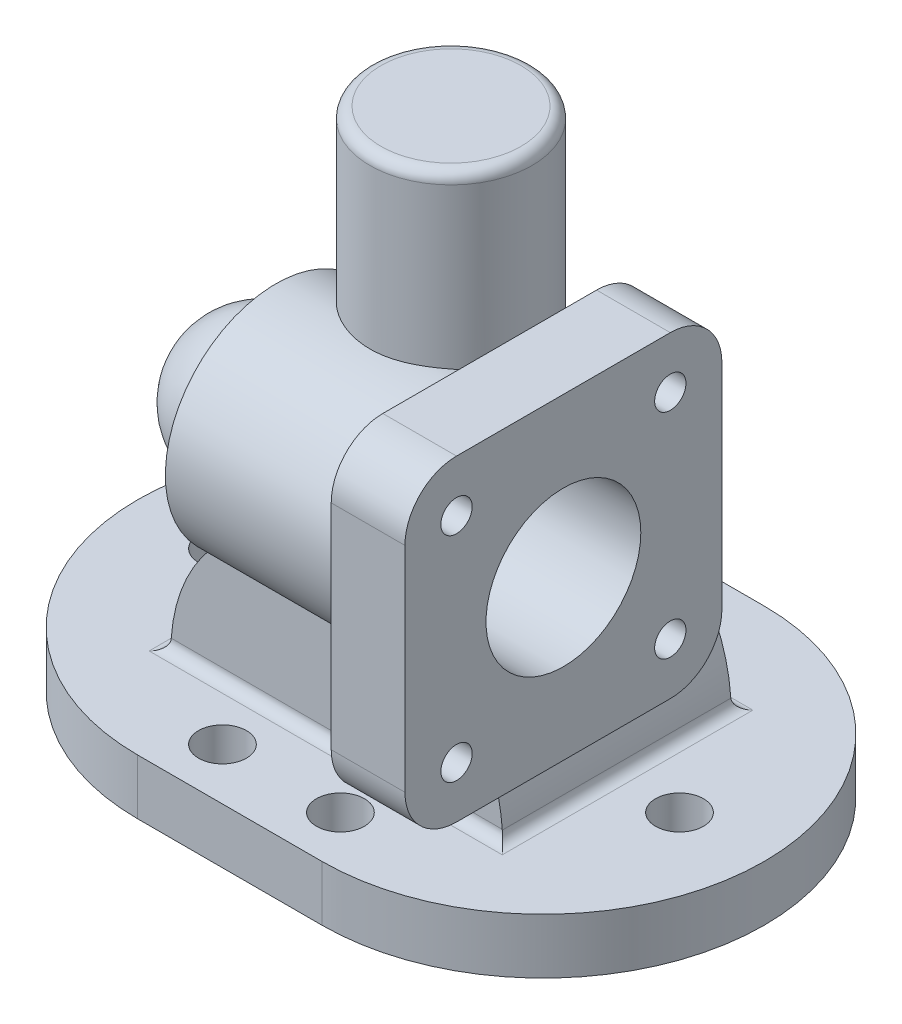
from build123d import *

# Parameters (mm, degrees)
EXTRUDE_1_DEPTH          = 15
EXTRUDE_2_DEPTH          = 31
EXTRUDE_START            = 30
SKETCH_3_W               = 86
SKETCH_3_H               = 86
EXTRUDE_3_DEPTH          = 20
SKETCH_4_R               = 30
EXTRUDE_4_DEPTH          = 58
SKETCH_5_R               = 22
EXTRUDE_5_DEPTH          = 150
SKETCH_6_R               = 20
EXTRUDE_6_DEPTH          = 4
DOME_1_FACE_RADIUS       = 20
DOME_1_HEIGHT            = 20
CUT_EXTRUDE_START        = -10
SKETCH_7_R               = 12
CUT_EXTRUDE_1_DEPTH      = 174.388249351
SKETCH_8_R               = 21
CUT_EXTRUDE_2_DEPTH      = 65
MM_1_D                   = 18
MM_1_DEPTH               = 20
MM_1_TIP                 = 5.407745571
CUT_EXTRUDE_3_DEPTH      = 21
FILLET_1_R               = 14
HOLE_WIZARD_M10_1_REACH  = 203.51
HOLE_WIZARD_M10_1_BORE_R = 4.25
SKETCH_14_R              = 6.5
CUT_EXTRUDE_4_DEPTH      = 172.336656986
FILLET_2_R               = 3
FILLET_3_R               = 3
FILLET_4_R               = 3
FILLET_5_R               = 3


with BuildPart() as part:
    # 草图1 → 凸台-拉伸1 (new body)
    with BuildSketch(Plane(origin=(0, 0, 0), x_dir=(1, 0, 0), z_dir=(0, 1, 0))):
        with BuildLine():
            Line((25, -60), (-25, -60))
            ThreePointArc((-25, -60), (-85, 0), (-25, 60))
            Line((-25, 60), (25, 60))
            ThreePointArc((25, 60), (85, 0), (25, -60))
        make_face()
    extrude(amount=EXTRUDE_1_DEPTH)

    # 草图2 → 凸台-拉伸2 (add, symmetric)
    with BuildSketch(Plane.XY):
        with BuildLine():
            ThreePointArc((45, 15), (0, 60), (-45, 15))
            Line((-45, 15), (-35, 15))
            ThreePointArc((-35, 15), (0, 50), (35, 15))
            Line((35, 15), (45, 15))
        make_face()
        with BuildLine():
            ThreePointArc((35, 15), (0, 50), (-35, 15))
            Line((-35, 15), (35, 15))
        make_face()
    extrude(amount=EXTRUDE_2_DEPTH, both=True)

    # 草图3 → 凸台-拉伸3 (add)
    with BuildSketch(Plane(origin=(0, 0, 0), x_dir=(0, 0, -1), z_dir=(1, 0, 0)).offset(EXTRUDE_START)):
        with Locations((-19.5, 74)):
            Rectangle(SKETCH_3_W, SKETCH_3_H)
    extrude(amount=EXTRUDE_3_DEPTH)

    # 草图4 → 凸台-拉伸4 (add)
    with BuildSketch(Plane.ZY.offset(-30)):
        with Locations((19.5, 74)):
            Circle(SKETCH_4_R)
    extrude(amount=EXTRUDE_4_DEPTH)

    # 草图5 → 凸台-拉伸5 (add)
    with BuildSketch(Plane.XZ):
        with Locations(Location((0, 0, 0), (0, 0, 270))):
            Circle(SKETCH_5_R)
    extrude(amount=-EXTRUDE_5_DEPTH)

    # 草图6 → 凸台-拉伸6 (add)
    with BuildSketch(Plane.ZY.offset(28)):
        with Locations((19.5, 74)):
            Circle(SKETCH_6_R)
    extrude(amount=EXTRUDE_6_DEPTH)

    # 圆顶1: a dome of height H over a round flat face of radius A is a cap of a sphere of radius (A * A + H * H) / (2 * H)
    dome_1_r = (DOME_1_FACE_RADIUS * DOME_1_FACE_RADIUS + DOME_1_HEIGHT * DOME_1_HEIGHT) / (2 * DOME_1_HEIGHT)
    dome_1_base = Plane((-32, 74, 19.5), z_dir=(-1, 0, 0))
    with Locations(dome_1_base.offset(DOME_1_HEIGHT - dome_1_r)):
        dome_1_ball = Sphere(dome_1_r, mode=Mode.PRIVATE)
    add(split(dome_1_ball, bisect_by=dome_1_base, keep=Keep.TOP, mode=Mode.PRIVATE))

    # 草图7 → 切除-拉伸1 (cut, through all)
    with BuildSketch(Plane(origin=(0, 150, 0), x_dir=(1, 0, 0), z_dir=(0, 1, 0)).offset(CUT_EXTRUDE_START)):
        with Locations(Location((0, 0, 0), (0, 0, 270))):
            Circle(SKETCH_7_R)
    extrude(amount=-CUT_EXTRUDE_1_DEPTH, mode=Mode.SUBTRACT)

    # 草图8 → 切除-拉伸2 (cut)
    with BuildSketch(Plane(origin=(50, 0, 0), x_dir=(0, 0, -1), z_dir=(1, 0, 0))):
        with Locations((-19.5, 74)):
            Circle(SKETCH_8_R)
    extrude(amount=-CUT_EXTRUDE_2_DEPTH, mode=Mode.SUBTRACT)

    # 大小mm 暗销孔1
    with Locations(Plane(origin=(-15, 74, 19.5), x_dir=(0, 0, 1), z_dir=(1, 0, 0))):
        with Locations((0, 0)):
            Hole(MM_1_D / 2, depth=MM_1_DEPTH)
            with Locations((0, 0, -(MM_1_DEPTH + MM_1_TIP / 2))):  # 118° drill point
                Cone(0, MM_1_D / 2, MM_1_TIP, mode=Mode.SUBTRACT)

    # 草图11 → 切除-拉伸3 (cut, symmetric)
    with BuildSketch(Plane.XY):
        with BuildLine():
            Line((-35, 15), (-35, 0))
            Line((-35, 0), (35, 0))
            Line((35, 0), (35, 15))
            ThreePointArc((35, 15), (0, 50), (-35, 15))
        make_face()
    extrude(amount=CUT_EXTRUDE_3_DEPTH, both=True, mode=Mode.SUBTRACT)

    # 圆角1
    fillet_1_edges = [part.edges().sort_by_distance(p)[0] for p in [
        (40, 117, 62.5),
        (40, 31, 62.5),
        (46.029740845, 31, -23.5),
        (40, 117, -23.5),
    ]]
    fillet(fillet_1_edges, radius=FILLET_1_R)

    # M10 螺纹孔1 bore (on position points) → M10 螺纹孔1 (cut, up to next)
    with BuildSketch(Plane(origin=(50, 103, 48.5), x_dir=(0, 0, 1), z_dir=(1, 0, 0)), mode=Mode.PRIVATE) as hole_wizard_m10_1_sk1:
        Circle(HOLE_WIZARD_M10_1_BORE_R)
    hole_wizard_m10_1_tool1 = extrude(hole_wizard_m10_1_sk1.sketch, amount=-HOLE_WIZARD_M10_1_REACH, mode=Mode.PRIVATE) & part.part
    # M10 螺纹孔1 bore (on position points) → M10 螺纹孔1 (cut, up to next)
    with BuildSketch(Plane(origin=(50, 103, 48.5), x_dir=(0, 0, 1), z_dir=(1, 0, 0)), mode=Mode.PRIVATE) as hole_wizard_m10_1_sk2:
        with Locations((-58, 0)):
            Circle(HOLE_WIZARD_M10_1_BORE_R)
    hole_wizard_m10_1_tool2 = extrude(hole_wizard_m10_1_sk2.sketch, amount=-HOLE_WIZARD_M10_1_REACH, mode=Mode.PRIVATE) & part.part
    # M10 螺纹孔1 bore (on position points) → M10 螺纹孔1 (cut, up to next)
    with BuildSketch(Plane(origin=(50, 103, 48.5), x_dir=(0, 0, 1), z_dir=(1, 0, 0)), mode=Mode.PRIVATE) as hole_wizard_m10_1_sk3:
        with Locations((-58, 58)):
            Circle(HOLE_WIZARD_M10_1_BORE_R)
    hole_wizard_m10_1_tool3 = extrude(hole_wizard_m10_1_sk3.sketch, amount=-HOLE_WIZARD_M10_1_REACH, mode=Mode.PRIVATE) & part.part
    # M10 螺纹孔1 bore (on position points) → M10 螺纹孔1 (cut, up to next)
    with BuildSketch(Plane(origin=(50, 103, 48.5), x_dir=(0, 0, 1), z_dir=(1, 0, 0)), mode=Mode.PRIVATE) as hole_wizard_m10_1_sk4:
        with Locations((0, 58)):
            Circle(HOLE_WIZARD_M10_1_BORE_R)
    hole_wizard_m10_1_tool4 = extrude(hole_wizard_m10_1_sk4.sketch, amount=-HOLE_WIZARD_M10_1_REACH, mode=Mode.PRIVATE) & part.part
    add(hole_wizard_m10_1_tool1.solids().sort_by_distance((50, 103, 48.5))[0], mode=Mode.SUBTRACT)
    add(hole_wizard_m10_1_tool2.solids().sort_by_distance((50, 103, -9.5))[0], mode=Mode.SUBTRACT)
    add(hole_wizard_m10_1_tool3.solids().sort_by_distance((50, 45, -9.5))[0], mode=Mode.SUBTRACT)
    add(hole_wizard_m10_1_tool4.solids().sort_by_distance((50, 45, 48.5))[0], mode=Mode.SUBTRACT)

    # 草图14 → 切除-拉伸4 (cut, through all)
    with BuildSketch(Plane(origin=(0, 15, 0), x_dir=(1, 0, 0), z_dir=(0, 1, 0))):
        with Locations(Location((-16, 46, 0), (0, 0, 270))):
            Circle(SKETCH_14_R)
        with Locations(Location((-62, 0, 0), (0, 0, 270))):
            Circle(SKETCH_14_R)
        with Locations(Location((-16, -46, 0), (0, 0, 270))):
            Circle(SKETCH_14_R)
    cut_extrude_4 = extrude(amount=-CUT_EXTRUDE_4_DEPTH, mode=Mode.SUBTRACT)

    # 镜向1: 切除-拉伸4 across plane
    add(cut_extrude_4.mirror(Plane(origin=(0, 0, 0), x_dir=(0, 0, 1), z_dir=(1, 0, 0))), mode=Mode.SUBTRACT)

    # 圆角2
    fillet_2_edges = [part.edges().sort_by_distance(p)[0] for p in [
        (0, 50, -21),
        (35, 7.5, -21),
        (-35, 7.5, -21),
        (0, 50, 21),
        (-35, 7.5, 21),
        (35, 7.5, 21),
    ]]
    fillet(fillet_2_edges, radius=FILLET_2_R)

    # 圆角3
    fillet_3_edges = [part.edges().sort_by_distance(p)[0] for p in [
        (0, 15, -31),
        (-45, 15, 0),
        (45, 15, 0),
        (0, 15, 31),
    ]]
    fillet(fillet_3_edges, radius=FILLET_3_R)

    # 圆角4
    fillet_4_edges = [part.edges().sort_by_distance(p)[0] for p in [
        (0, 150, 22),
    ]]
    fillet(fillet_4_edges, radius=FILLET_4_R)

    # 圆角5
    fillet_5_edges = [part.edges().sort_by_distance(p)[0] for p in [
        (1, 46.291697995, 31),
    ]]
    fillet(fillet_5_edges, radius=FILLET_5_R)


solid = part.part
